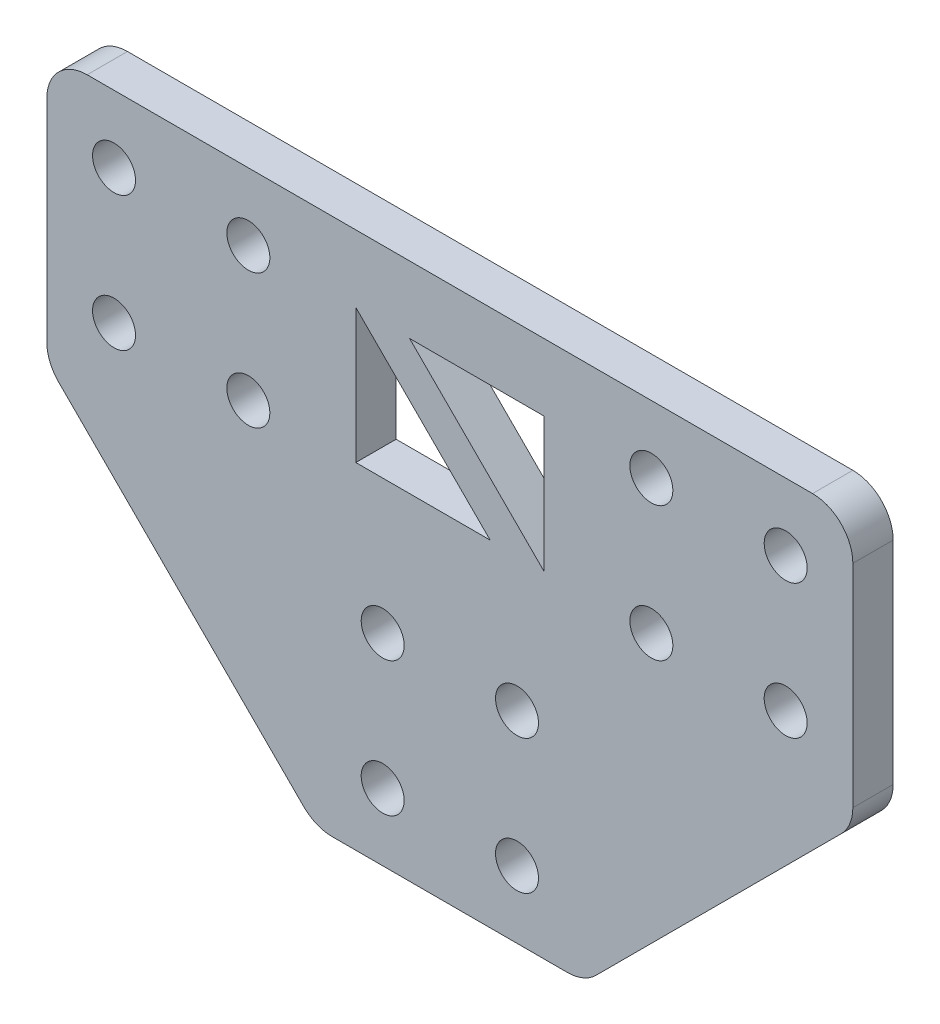
from build123d import *

# Parameters (mm, degrees)
SKETCH_1_R      = 1.6
EXTRUDE_1_DEPTH = 3
FILLET_1_R      = 3


with BuildPart() as part:
    # 草图1 → 凸台-拉伸1 (new body)
    with BuildSketch(Plane.XY):
        Polygon((0, 0), (60, 0), (60, -20), (40, -40), (20, -40), (0, -20), align=None)
        with Locations((5, -5)):
            Circle(SKETCH_1_R, mode=Mode.SUBTRACT)
        with Locations(Location((15, -5, 0), (0, 0, 180))):
            Circle(SKETCH_1_R, mode=Mode.SUBTRACT)
        with Locations((15, -15)):
            Circle(SKETCH_1_R, mode=Mode.SUBTRACT)
        with Locations(Location((5, -15, 0), (0, 0, 180))):
            Circle(SKETCH_1_R, mode=Mode.SUBTRACT)
        with Locations((55, -15)):
            Circle(SKETCH_1_R, mode=Mode.SUBTRACT)
        with Locations(Location((45, -15, 0), (0, 0, 180))):
            Circle(SKETCH_1_R, mode=Mode.SUBTRACT)
        with Locations((45, -5)):
            Circle(SKETCH_1_R, mode=Mode.SUBTRACT)
        with Locations(Location((55, -5, 0), (0, 0, 180))):
            Circle(SKETCH_1_R, mode=Mode.SUBTRACT)
        with Locations((25, -35)):
            Circle(SKETCH_1_R, mode=Mode.SUBTRACT)
        with Locations(Location((35, -35, 0), (0, 0, 180))):
            Circle(SKETCH_1_R, mode=Mode.SUBTRACT)
        with Locations((35, -25)):
            Circle(SKETCH_1_R, mode=Mode.SUBTRACT)
        with Locations(Location((25, -25, 0), (0, 0, 180))):
            Circle(SKETCH_1_R, mode=Mode.SUBTRACT)
        Polygon((23, -5), (23, -15), (33, -15), align=None, mode=Mode.SUBTRACT)
        Polygon((27, -5), (37, -5), (37, -15), align=None, mode=Mode.SUBTRACT)
    extrude(amount=EXTRUDE_1_DEPTH)

    # 圆角1
    fillet_1_edges = [part.edges().sort_by_distance(p)[0] for p in [
        (0, 0, 1.5),
        (60, 0, 1.5),
        (60, -20, 1.5),
        (40, -40, 1.5),
        (20, -40, 1.5),
        (0, -20, 1.5),
    ]]
    fillet(fillet_1_edges, radius=FILLET_1_R)


solid = part.part
